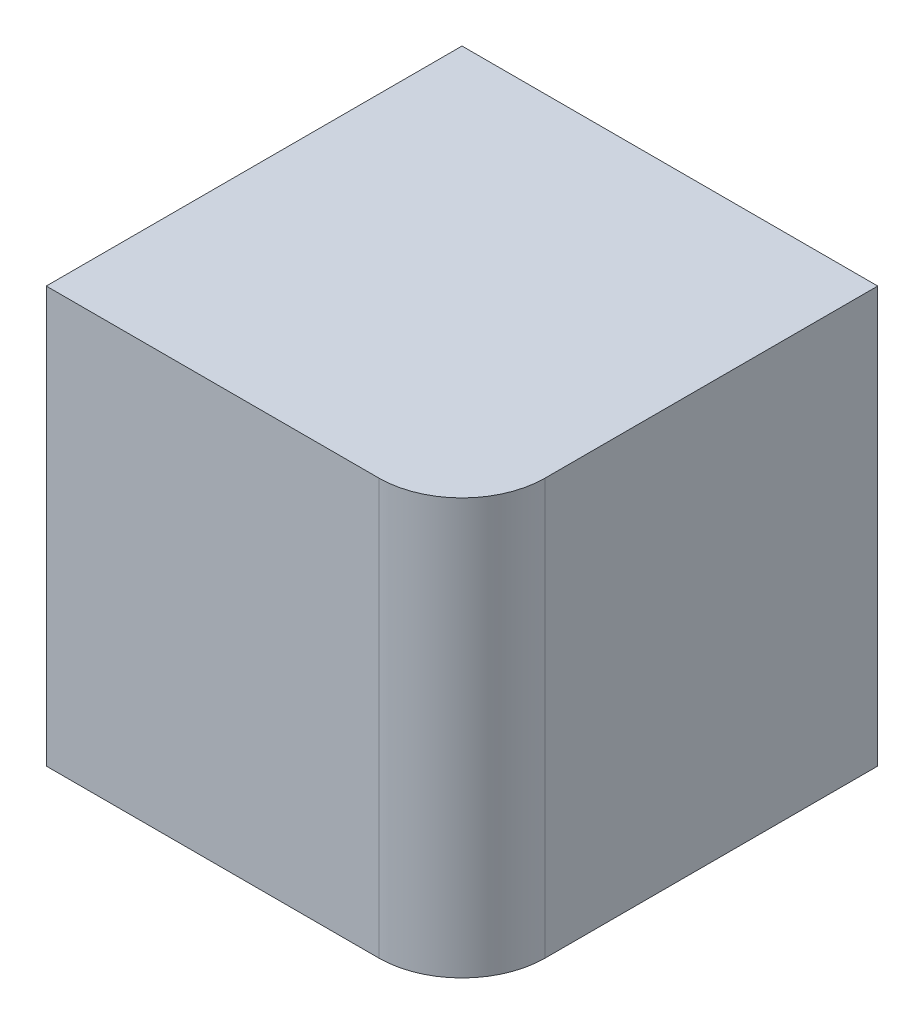
from build123d import *

# Parameters (mm, degrees)
SKETCH_1_W      = 10
SKETCH_1_H      = 10
EXTRUDE_1_DEPTH = 10
FILLET_1_R      = 2


with BuildPart() as part:
    # 草图1 → 凸台-拉伸1 (new body)
    with BuildSketch(Plane.XY):
        with Locations((5, 5)):
            Rectangle(SKETCH_1_W, SKETCH_1_H)
    extrude(amount=EXTRUDE_1_DEPTH)

    # 圆角1
    fillet_1_edges = [part.edges().sort_by_distance(p)[0] for p in [
        (10, 5, 10),
    ]]
    fillet(fillet_1_edges, radius=FILLET_1_R)


solid = part.part
